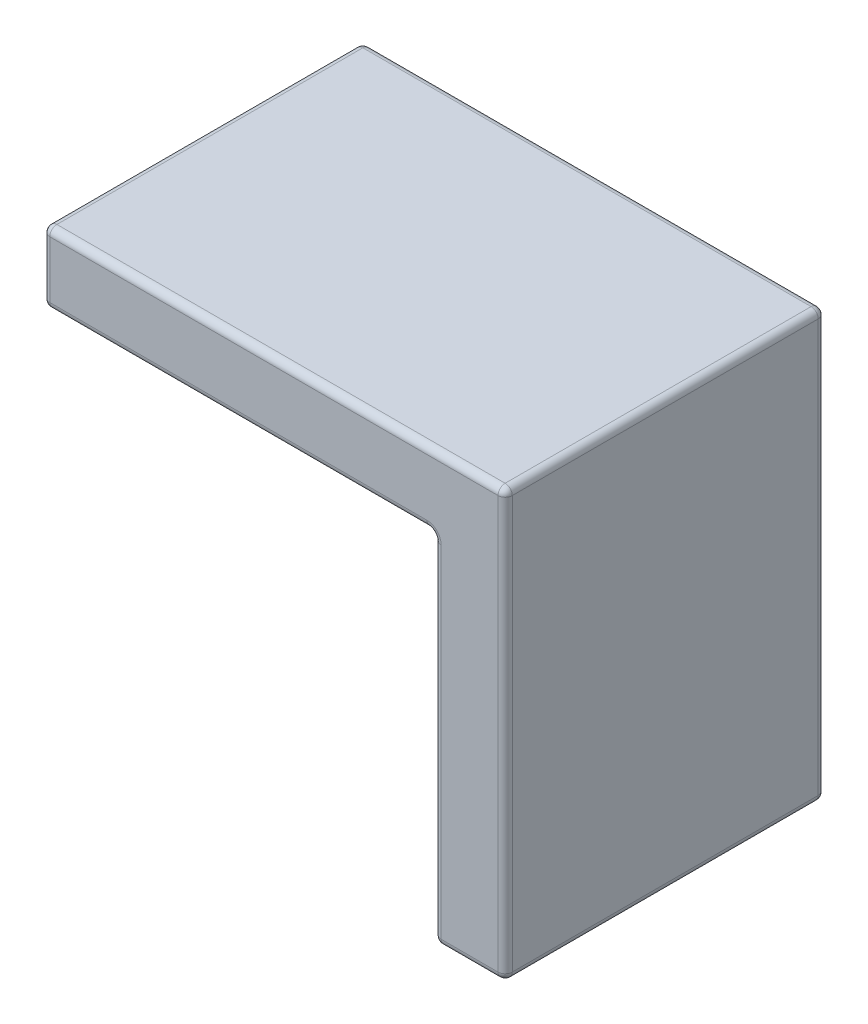
from build123d import *

# Parameters (mm, degrees)
SKIZZE1_W                       = 10
SKIZZE1_H                       = 50
AUFSATZ_LINEAR_AUSTRAGEN1_DEPTH = 45
SKIZZE2_R                       = 2.3
SCHNITT_LINEAR_AUSTRAGEN1_DEPTH = 10
SKIZZE3_R                       = 2.3
SCHNITT_LINEAR_AUSTRAGEN2_DEPTH = 10
SKIZZE4_R                       = 2.15
SCHNITT_LINEAR_AUSTRAGEN3_DEPTH = 10
VERRUNDUNG1_R                   = 1


with BuildPart() as part:
    # Skizze1 → Aufsatz-Linear austragen1 (new body)
    with BuildSketch(Plane.XY):
        Polygon((-32.5, 30), (-32.5, 20), (22.5, 20), (32.5, 20), (32.5, 30), align=None)
        with Locations((27.5, -5)):
            Rectangle(SKIZZE1_W, SKIZZE1_H)
    extrude(amount=AUFSATZ_LINEAR_AUSTRAGEN1_DEPTH)

    # Skizze2 → Schnitt-Linear austragen1 (cut)
    with BuildSketch(Plane.XZ.offset(30)):
        with Locations(Location((27.5, 15, 0), (0, 0, 270))):
            Circle(SKIZZE2_R)
        with Locations(Location((27.5, 35, 0), (0, 0, 270))):
            Circle(SKIZZE2_R)
    extrude(amount=-SCHNITT_LINEAR_AUSTRAGEN1_DEPTH, mode=Mode.SUBTRACT)

    # Skizze3 → Schnitt-Linear austragen2 (cut)
    with BuildSketch(Plane.ZY.offset(32.5)):
        with Locations((15, 25)):
            Circle(SKIZZE3_R)
        with Locations((35, 25)):
            Circle(SKIZZE3_R)
    extrude(amount=-SCHNITT_LINEAR_AUSTRAGEN2_DEPTH, mode=Mode.SUBTRACT)

    # Skizze4 → Schnitt-Linear austragen3 (cut)
    with BuildSketch(Plane(origin=(0, 0, 0), x_dir=(-1, 0, 0), z_dir=(0, 0, -1))):
        with Locations((-17.5, 25)):
            Circle(SKIZZE4_R)
        with Locations((2.5, 25)):
            Circle(SKIZZE4_R)
        with Locations((22.5, 25)):
            Circle(SKIZZE4_R)
    extrude(amount=-SCHNITT_LINEAR_AUSTRAGEN3_DEPTH, mode=Mode.SUBTRACT)

    # Verrundung1
    verrundung1_edges = [part.edges().sort_by_distance(p)[0] for p in [
        (22.5, -5, 0),
        (-5, 20, 0),
        (-5, 20, 45),
        (-32.5, 25, 0),
        (-32.5, 30, 22.5),
        (32.5, 30, 22.5),
        (32.5, -30, 22.5),
        (22.5, -30, 22.5),
        (22.5, 20, 22.5),
        (-32.5, 20, 22.5),
        (22.5, -5, 45),
        (27.5, -30, 45),
        (27.5, -30, 17.3),
        (32.5, 0, 45),
        (27.5, -30, 37.3),
        (0, 30, 45),
        (-32.5, 25, 12.7),
        (-32.5, 25, 32.7),
        (19.65, 25, 0),
        (-0.35, 25, 0),
        (-32.5, 25, 45),
        (-20.35, 25, 0),
        (0, 30, 0),
        (32.5, 0, 0),
        (27.5, -30, 0),
    ]]
    fillet(verrundung1_edges, radius=VERRUNDUNG1_R)


solid = part.part
